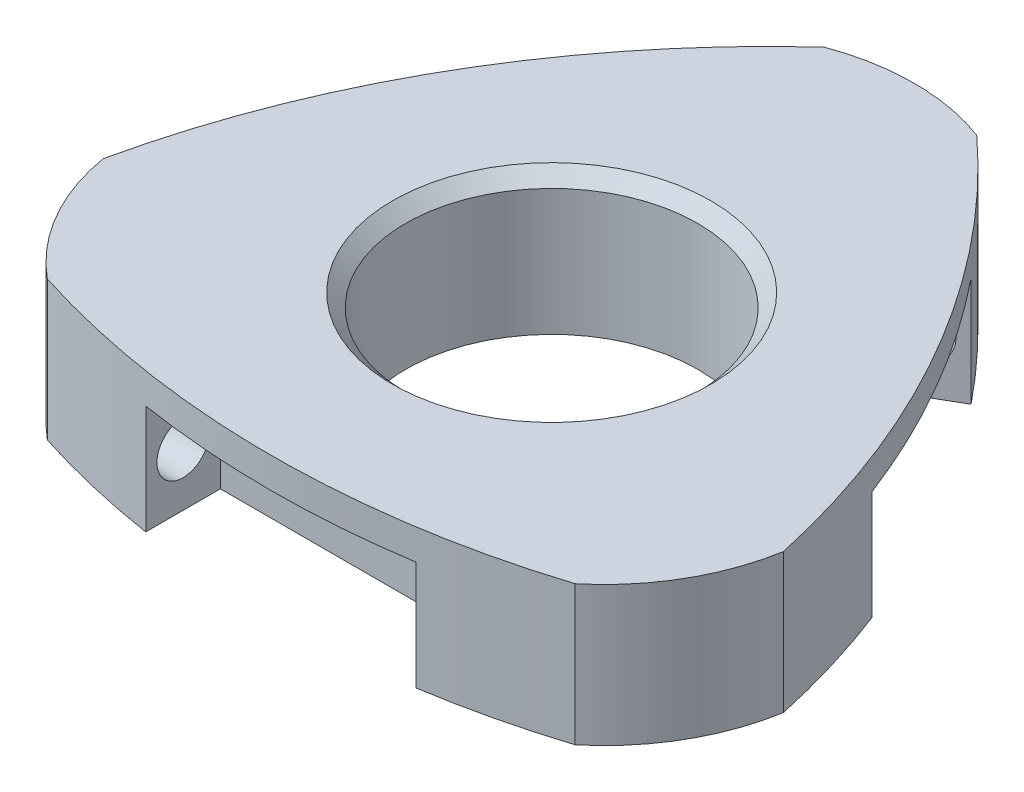
from build123d import *

# Parameters (mm, degrees)
SKETCH1_R           = 33.5
BOSS_EXTRUDE1_DEPTH = 32
CHAMFER1_SIZE       = 3
SKETCH2_W           = 62
SKETCH2_H           = 20
CUT_EXTRUDE1_DEPTH  = 25
SKETCH3_R           = 6
CUT_EXTRUDE2_DEPTH  = 40
CIRPATTERN1_COUNT   = 3


with BuildPart() as part:
    # Sketch1 → Boss-Extrude1 (new body)
    with BuildSketch(Plane(origin=(0, 0, 0), x_dir=(1, 0, 0), z_dir=(0, 1, 0))):
        with BuildLine():
            ThreePointArc((17.5, 80), (55.889587347, 32.2678683), (78.032032303, -24.844555434))
            ThreePointArc((78.032032303, -24.844555434), (72.020850643, -41.581257506), (60.532032303, -55.155444566))
            ThreePointArc((60.532032303, -55.155444566), (0, -64.5357366), (-60.532032303, -55.155444566))
            ThreePointArc((-60.532032303, -55.155444566), (-72.020850643, -41.581257506), (-78.032032303, -24.844555434))
            ThreePointArc((-78.032032303, -24.844555434), (-55.889587347, 32.2678683), (-17.5, 80))
            ThreePointArc((-17.5, 80), (0, 83.162515012), (17.5, 80))
        make_face()
        with Locations(Location((0, 0, 0), (0, 0, 270))):
            Circle(SKETCH1_R, mode=Mode.SUBTRACT)
    extrude(amount=BOSS_EXTRUDE1_DEPTH)

    # Chamfer1
    chamfer1_edges = [part.edges().sort_by_distance(p)[0] for p in [
        (0, 32, -33.5),
    ]]
    chamfer(chamfer1_edges, length=CHAMFER1_SIZE)

    # Sketch2 → Cut-Extrude1 (cut)
    with BuildSketch(Plane.XZ):
        with Locations((0, 55)):
            Rectangle(SKETCH2_W, SKETCH2_H)
    cut_extrude1 = extrude(amount=-CUT_EXTRUDE1_DEPTH, mode=Mode.SUBTRACT)

    # Sketch3 → Cut-Extrude2 (cut, symmetric)
    with BuildSketch(Plane(origin=(0, 0, 0), x_dir=(0, 0, -1), z_dir=(1, 0, 0))):
        with Locations(Location((-53.559315298, 12.5, 0), (0, 0, 180))):
            Circle(SKETCH3_R)
    cut_extrude2 = extrude(amount=CUT_EXTRUDE2_DEPTH, both=True, mode=Mode.SUBTRACT)

    # CirPattern1: Cut-Extrude1, Cut-Extrude2 ×3 about axis
    cirpattern1_axis = Axis((0, 0, 0), (0, 1, 0))
    add([cut_extrude1.rotate(cirpattern1_axis, i * 360 / CIRPATTERN1_COUNT) for i in range(1, CIRPATTERN1_COUNT)], mode=Mode.SUBTRACT)
    add([cut_extrude2.rotate(cirpattern1_axis, i * 360 / CIRPATTERN1_COUNT) for i in range(1, CIRPATTERN1_COUNT)], mode=Mode.SUBTRACT)


solid = part.part
